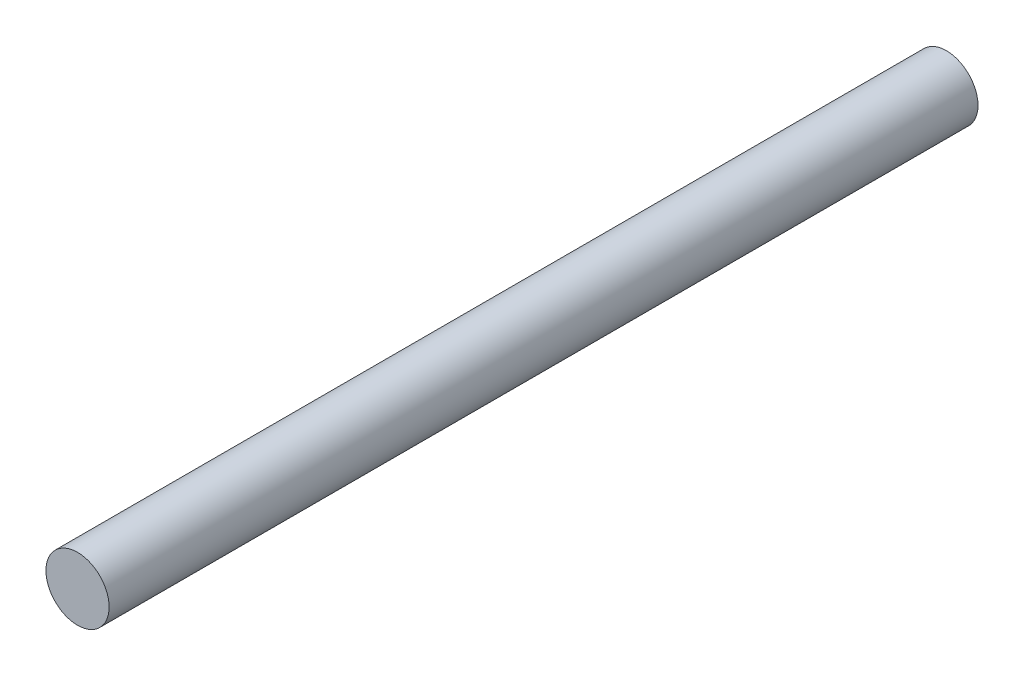
from build123d import *

# Parameters (mm, degrees)
BOSS_EXTRUDE1_DEPTH      = 41.25
BOSS_EXTRUDE1_DEPTH_BACK = 41.25
SKETCH1_R                = 3


with BuildPart() as part:
    # Sketch1 → Boss-Extrude1 (new, two sides: drawn at the far end of the back side and taken through both)
    with BuildSketch(Plane.XY.offset(-BOSS_EXTRUDE1_DEPTH_BACK)):
        Circle(SKETCH1_R)
    extrude(amount=BOSS_EXTRUDE1_DEPTH + BOSS_EXTRUDE1_DEPTH_BACK)


solid = part.part
